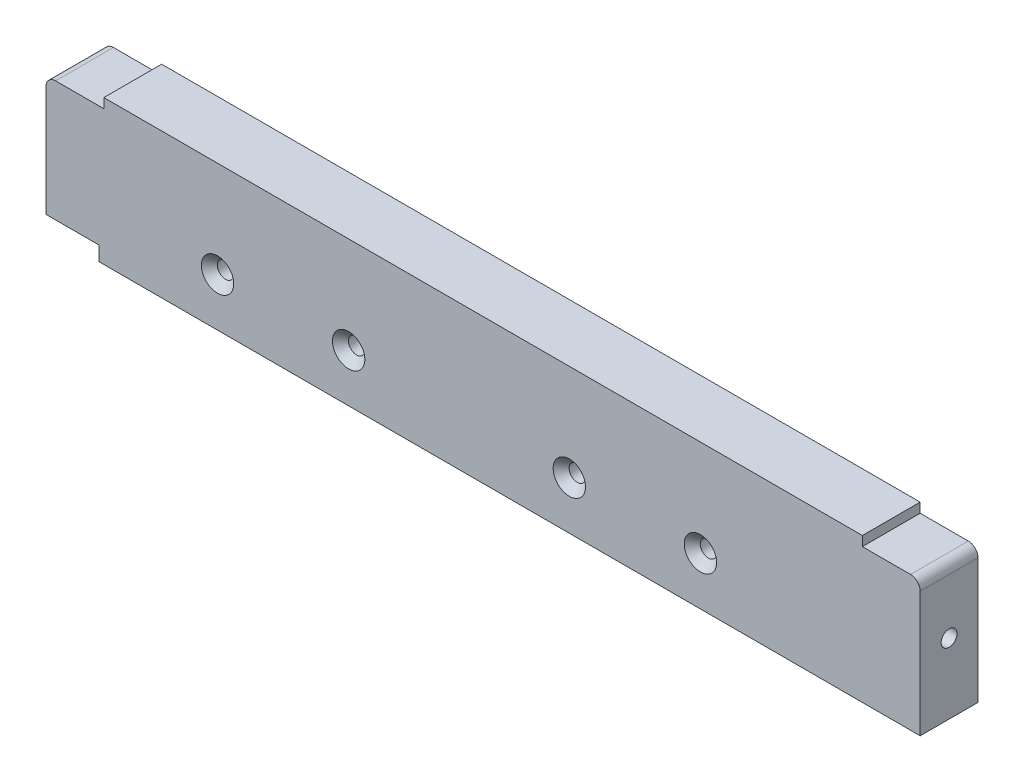
from build123d import *

# Parameters (mm, degrees)
ESBO_O1_W                                      = 119
ESBO_O1_H                                      = 30
RESSALTO_EXTRUS_O1_DEPTH                       = 12
ESCAREADO_PARA_SFHCS_M31_D                     = 3.4
ESCAREADO_PARA_SFHCS_M31_CSINK_D               = 6.72
ESCAREADO_PARA_SFHCS_M31_CSINK_ANGLE           = 90
ESBO_O8_W                                      = 26.2
ESBO_O8_H                                      = 30
RESSALTO_EXTRUS_O2_DEPTH                       = 12
ESBO_O9_W                                      = 36.2
ESBO_O9_H                                      = 30
RESSALTO_EXTRUS_O3_DEPTH                       = 12
ESBO_O10_W                                     = 12
ESBO_O10_H                                     = 12
CORTE_EXTRUS_O1_DEPTH                          = 2
FILETE1_R                                      = 2
ESBO_O12_W                                     = 11
ESBO_O12_H                                     = 12
CORTE_EXTRUS_O2_DEPTH                          = 3
BROCA_DE_ROSQUEAR_PARA_TARRAXA_DE_M4X0_7_D     = 3.3
BROCA_DE_ROSQUEAR_PARA_TARRAXA_DE_M4X0_7_DEPTH = 10
BROCA_DE_ROSQUEAR_PARA_TARRAXA_DE_M4X0_7_TIP   = 0.991420021
ESBO_O15_W                                     = 12
ESBO_O15_H                                     = 12
CORTE_EXTRUS_O3_DEPTH                          = 2
FILETE2_R                                      = 2
BROCA_DE_ROSQUEAR_PARA_TARRAXA_DE_M4_2_D       = 3.3
BROCA_DE_ROSQUEAR_PARA_TARRAXA_DE_M4_2_DEPTH   = 10
BROCA_DE_ROSQUEAR_PARA_TARRAXA_DE_M4_2_TIP     = 0.991420021


with BuildPart() as part:
    # Esboço1 → Ressalto-extrusão1 (new body)
    with BuildSketch(Plane.XY):
        with Locations((-3.319388577, 184.927849727)):
            Rectangle(ESBO_O1_W, ESBO_O1_H)
    extrude(amount=RESSALTO_EXTRUS_O1_DEPTH)

    # Escareado para SFHCS M31 (through all)
    with Locations(Plane.XY.offset(12)):
        with Locations((46.780611423, 179.927849727), (-53.419388577, 179.927849727), (-26.219388577, 179.927849727), (19.580611423, 179.927849727)):
            CounterSinkHole(ESCAREADO_PARA_SFHCS_M31_D / 2, ESCAREADO_PARA_SFHCS_M31_CSINK_D / 2, counter_sink_angle=ESCAREADO_PARA_SFHCS_M31_CSINK_ANGLE)

    # Esboço8 → Ressalto-extrusão2 (add)
    with BuildSketch(Plane.XY.offset(12)):
        with Locations((-75.919388577, 184.927849727)):
            Rectangle(ESBO_O8_W, ESBO_O8_H)
    extrude(amount=-RESSALTO_EXTRUS_O2_DEPTH)

    # Esboço9 → Ressalto-extrusão3 (add)
    with BuildSketch(Plane.XY):
        with Locations((74.280611423, 184.927849727)):
            Rectangle(ESBO_O9_W, ESBO_O9_H)
    extrude(amount=RESSALTO_EXTRUS_O3_DEPTH)

    # Esboço10 → Corte-extrusão1 (cut)
    with BuildSketch(Plane(origin=(0, 199.927849727, 0), x_dir=(1, 0, 0), z_dir=(0, 1, 0))):
        with Locations((-83.019388577, -6)):
            Rectangle(ESBO_O10_W, ESBO_O10_H)
    extrude(amount=-CORTE_EXTRUS_O1_DEPTH, mode=Mode.SUBTRACT)

    # Filete1
    filete1_edges = [part.edges().sort_by_distance(p)[0] for p in [
        (-89.019388577, 197.927849727, 6),
    ]]
    fillet(filete1_edges, radius=FILETE1_R)

    # Esboço12 → Corte-extrusão2 (cut)
    with BuildSketch(Plane.XZ.offset(-169.927849727)):
        with Locations((-83.519388577, 6)):
            Rectangle(ESBO_O12_W, ESBO_O12_H)
    extrude(amount=-CORTE_EXTRUS_O2_DEPTH, mode=Mode.SUBTRACT)

    # Broca de rosquear para tarraxa de M4x0.7
    with Locations(Plane.ZY.offset(89.019388577)):
        with Locations((6, 184.677849727)):
            Hole(BROCA_DE_ROSQUEAR_PARA_TARRAXA_DE_M4X0_7_D / 2, depth=BROCA_DE_ROSQUEAR_PARA_TARRAXA_DE_M4X0_7_DEPTH)
            with Locations((0, 0, -(BROCA_DE_ROSQUEAR_PARA_TARRAXA_DE_M4X0_7_DEPTH + BROCA_DE_ROSQUEAR_PARA_TARRAXA_DE_M4X0_7_TIP / 2))):  # 118° drill point
                Cone(0, BROCA_DE_ROSQUEAR_PARA_TARRAXA_DE_M4X0_7_D / 2, BROCA_DE_ROSQUEAR_PARA_TARRAXA_DE_M4X0_7_TIP, mode=Mode.SUBTRACT)

    # Esboço15 → Corte-extrusão3 (cut)
    with BuildSketch(Plane(origin=(0, 199.927849727, 0), x_dir=(-1, 0, 0), z_dir=(0, 1, 0))):
        with Locations((-86.380611423, 6)):
            Rectangle(ESBO_O15_W, ESBO_O15_H)
    extrude(amount=-CORTE_EXTRUS_O3_DEPTH, mode=Mode.SUBTRACT)

    # Filete2
    filete2_edges = [part.edges().sort_by_distance(p)[0] for p in [
        (92.380611423, 197.927849727, 6),
    ]]
    fillet(filete2_edges, radius=FILETE2_R)

    # Broca de rosquear para tarraxa de M4 2
    with Locations(Plane(origin=(92.380611423, 0, 0), x_dir=(0, 0, -1), z_dir=(1, 0, 0))):
        with Locations((-6, 184.4862903)):
            Hole(BROCA_DE_ROSQUEAR_PARA_TARRAXA_DE_M4_2_D / 2, depth=BROCA_DE_ROSQUEAR_PARA_TARRAXA_DE_M4_2_DEPTH)
            with Locations((0, 0, -(BROCA_DE_ROSQUEAR_PARA_TARRAXA_DE_M4_2_DEPTH + BROCA_DE_ROSQUEAR_PARA_TARRAXA_DE_M4_2_TIP / 2))):  # 118° drill point
                Cone(0, BROCA_DE_ROSQUEAR_PARA_TARRAXA_DE_M4_2_D / 2, BROCA_DE_ROSQUEAR_PARA_TARRAXA_DE_M4_2_TIP, mode=Mode.SUBTRACT)


solid = part.part
